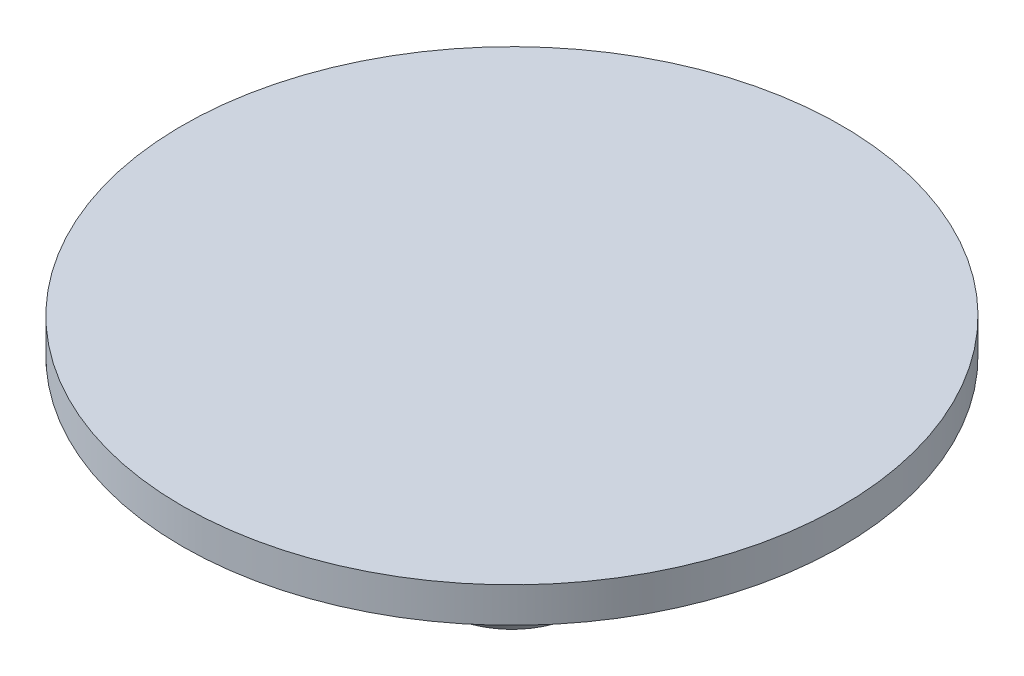
from build123d import *

# Parameters (mm, degrees)
SKETCH2_R          = 1.25
CUT_EXTRUDE1_DEPTH = 10


with BuildPart() as part:
    # Sketch1 → Revolve1 (revolve)
    with BuildSketch(Plane.XY, mode=Mode.PRIVATE) as revolve1_sk:
        Polygon((0, 0), (0, -1.5), (2, -1.5), (2, -9.5), (3, -9.5), (6.85, -1.5), (14.1, -1.5), (14.1, 0), align=None)
    revolve(revolve1_sk.sketch.rotate(Axis((0, 0, 0), (0, -1, 0)), 90), axis=Axis((0, 0, 0), (0, -1, 0)))

    # Sketch2 → Cut-Extrude1 (cut)
    with BuildSketch(Plane.XY):
        with Locations((0, -5.6)):
            Circle(SKETCH2_R)
    extrude(amount=-CUT_EXTRUDE1_DEPTH, mode=Mode.SUBTRACT)


solid = part.part
